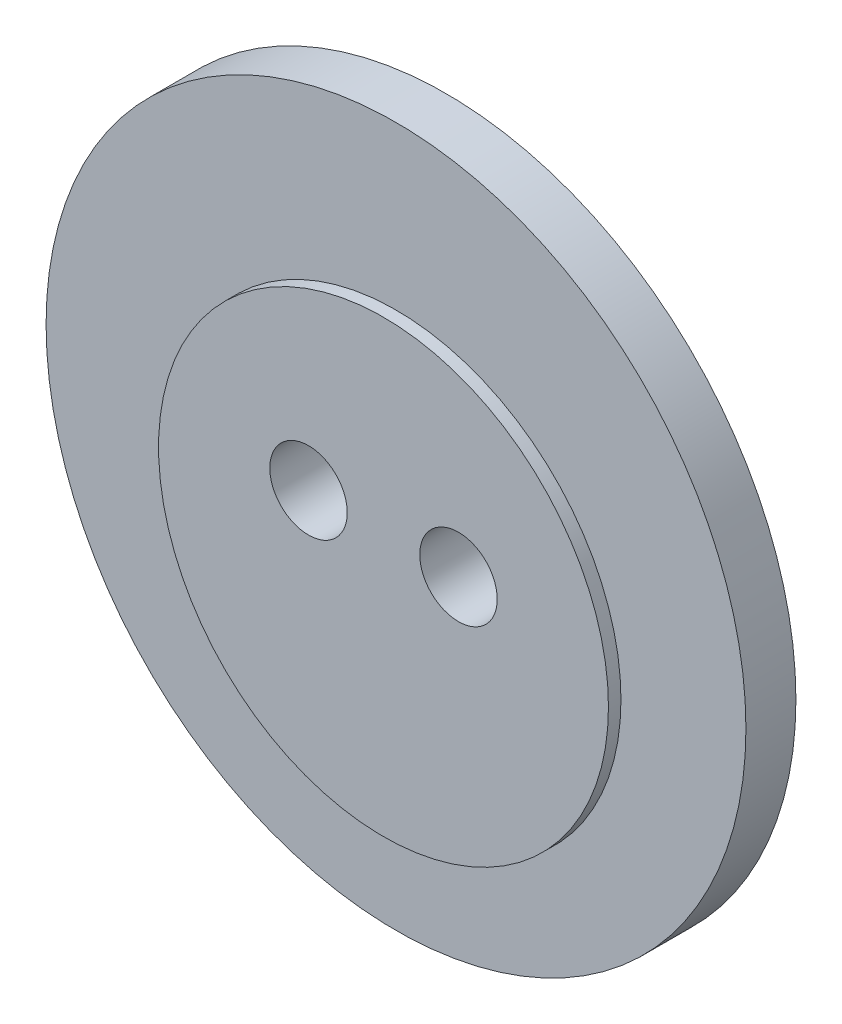
from build123d import *

# Parameters (mm, degrees)
SKETCH1_R           = 14
BOSS_EXTRUDE1_DEPTH = 2
SKETCH2_R           = 9
BOSS_EXTRUDE2_DEPTH = 0.5
SKETCH6_R           = 9
BOSS_EXTRUDE4_DEPTH = 0.5
SKETCH7_R           = 1.55
CUT_EXTRUDE1_DEPTH  = 21.024984395


with BuildPart() as part:
    # Sketch1 → Boss-Extrude1 (new body)
    with BuildSketch(Plane.XY):
        Circle(SKETCH1_R)
    extrude(amount=BOSS_EXTRUDE1_DEPTH)

    # Sketch2 → Boss-Extrude2 (add)
    with BuildSketch(Plane.XY.offset(2)):
        with Locations((0, -1.5)):
            Circle(SKETCH2_R)
    extrude(amount=BOSS_EXTRUDE2_DEPTH)

    # Sketch6 → Boss-Extrude4 (add)
    with BuildSketch(Plane(origin=(0, 0, 0), x_dir=(-1, 0, 0), z_dir=(0, 0, -1))):
        with Locations((0, 1.5)):
            Circle(SKETCH6_R)
    extrude(amount=BOSS_EXTRUDE4_DEPTH)

    # Sketch7 → Cut-Extrude1 (cut, through all)
    with BuildSketch(Plane.XY.offset(2.5)):
        with Locations((3, 0)):
            Circle(SKETCH7_R)
        with Locations(Location((-3, 0, 0), (0, 0, 180))):
            Circle(SKETCH7_R)
    extrude(amount=-CUT_EXTRUDE1_DEPTH, mode=Mode.SUBTRACT)


solid = part.part
